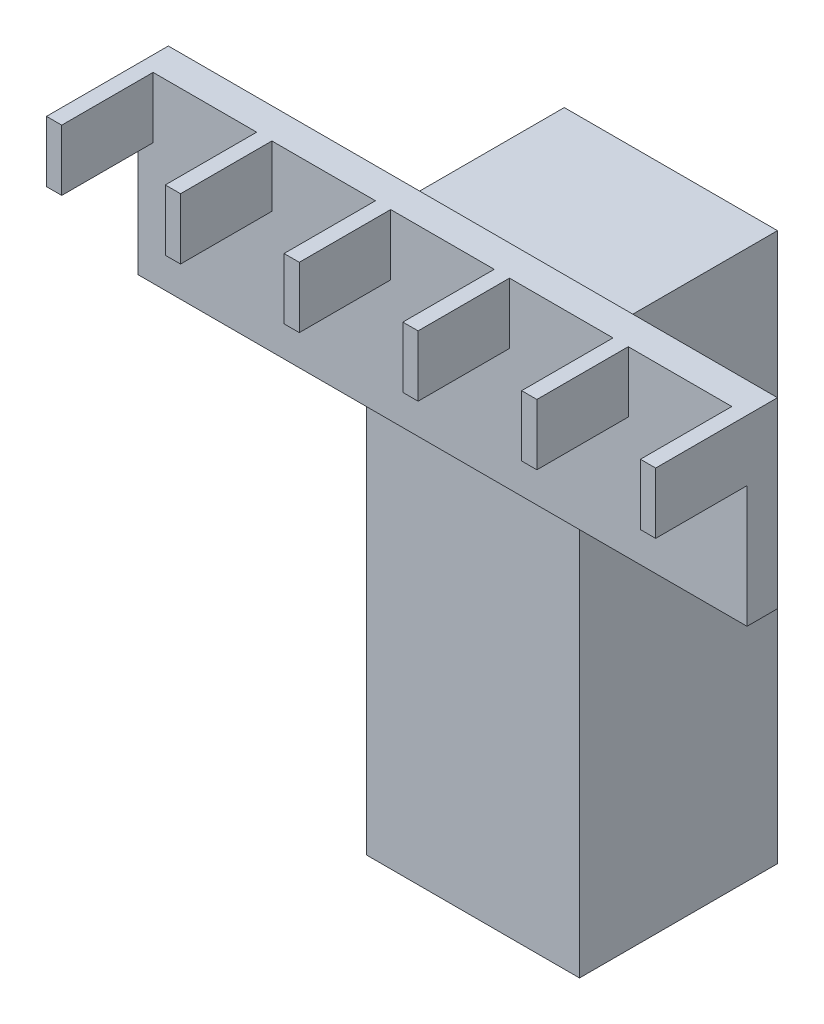
from build123d import *

# Parameters (mm, degrees)
SKETCH1_W           = 127
SKETCH1_H           = 38.1
BOSS_EXTRUDE1_DEPTH = 6.35
SKETCH2_W           = 3.175
SKETCH2_H           = 12.7
BOSS_EXTRUDE2_DEPTH = 19.05
SKETCH3_W           = 44.45
SKETCH3_H           = 114.3
BOSS_EXTRUDE3_DEPTH = 41.275
SKETCH4_W           = 38.1
SKETCH4_H           = 34.925
CUT_EXTRUDE1_DEPTH  = 50.8
SKETCH5_R           = 6.35
CUT_EXTRUDE2_DEPTH  = 23.8125


with BuildPart() as part:
    # Sketch1 → Boss-Extrude1 (new body)
    with BuildSketch(Plane.XY):
        with Locations((63.5, 19.05)):
            Rectangle(SKETCH1_W, SKETCH1_H)
    extrude(amount=BOSS_EXTRUDE1_DEPTH)

    # Sketch2 → Boss-Extrude2 (add)
    with BuildSketch(Plane.XY.offset(6.35)):
        with Locations((26.3525, 31.75)):
            Rectangle(SKETCH2_W, SKETCH2_H)
        with Locations((1.5875, 31.75)):
            Rectangle(SKETCH2_W, SKETCH2_H)
        with Locations((51.1175, 31.75)):
            Rectangle(SKETCH2_W, SKETCH2_H)
        with Locations((75.8825, 31.75)):
            Rectangle(SKETCH2_W, SKETCH2_H)
        with Locations((100.6475, 31.75)):
            Rectangle(SKETCH2_W, SKETCH2_H)
        with Locations((125.4125, 31.75)):
            Rectangle(SKETCH2_W, SKETCH2_H)
    extrude(amount=BOSS_EXTRUDE2_DEPTH)

    # Sketch3 → Boss-Extrude3 (add)
    with BuildSketch(Plane(origin=(0, 0, 0), x_dir=(-1, 0, 0), z_dir=(0, 0, -1))):
        with Locations((-63.5, -30.1625)):
            Rectangle(SKETCH3_W, SKETCH3_H)
    extrude(amount=BOSS_EXTRUDE3_DEPTH)

    # Sketch4 → Cut-Extrude1 (cut)
    with BuildSketch(Plane.XZ.offset(87.3125)):
        with Locations((63.5, -20.6375)):
            Rectangle(SKETCH4_W, SKETCH4_H)
    extrude(amount=-CUT_EXTRUDE1_DEPTH, mode=Mode.SUBTRACT)

    # Sketch5 → Cut-Extrude2 (cut)
    with BuildSketch(Plane(origin=(0, 0, -41.275), x_dir=(-1, 0, 0), z_dir=(0, 0, -1))):
        with Locations((-73.025, -49.2125)):
            Circle(SKETCH5_R)
        with Locations((-53.975, -49.2125)):
            Circle(SKETCH5_R)
    extrude(amount=-CUT_EXTRUDE2_DEPTH, mode=Mode.SUBTRACT)


solid = part.part
